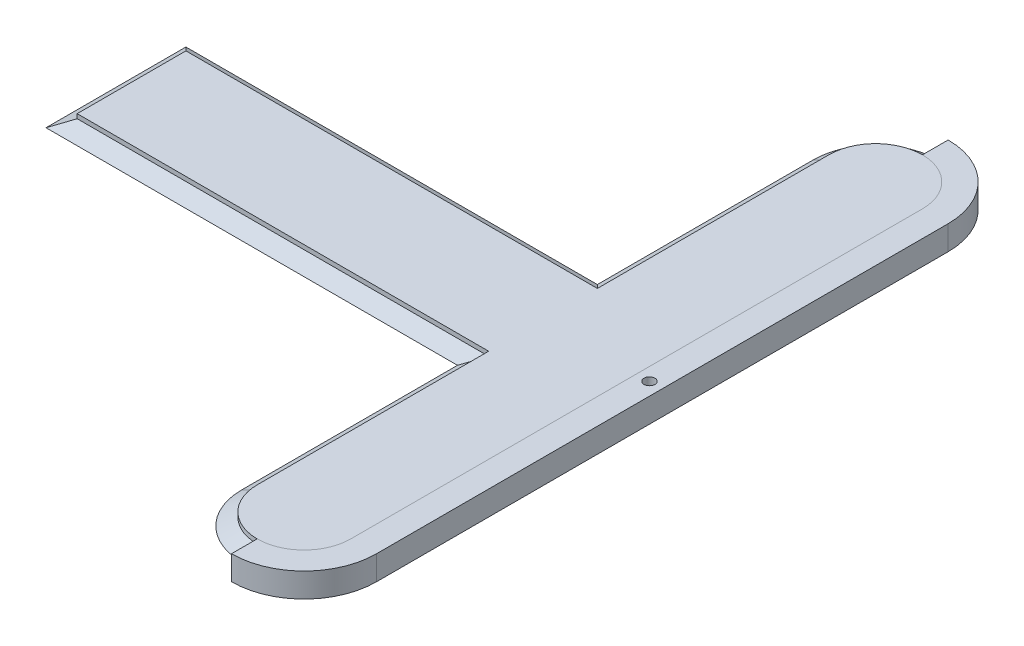
from build123d import *

# Parameters (mm, degrees)
BOSS_EXTRUDE1_DEPTH = 6
BOSS_EXTRUDE2_DEPTH = 6
SKETCH6_R           = 1.35
CUT_EXTRUDE1_DEPTH  = 17.78


with BuildPart() as part:
    # Sketch1 → Boss-Extrude1 (new body)
    with BuildSketch(Plane(origin=(0, 0, 0), x_dir=(1, 0, 0), z_dir=(0, 1, 0))):
        with BuildLine():
            Line((0, -13.421553628), (101.6, -13.421553628))
            Line((101.6, -13.421553628), (101.6, -70.571553628))
            ThreePointArc((101.6, -70.571553628), (113.157, -82.128553628), (124.714, -70.571553628))
            Line((124.714, -70.571553628), (124.714, 70.571553628))
            ThreePointArc((124.714, 70.571553628), (113.157, 82.128553628), (101.6, 70.571553628))
            Line((101.6, 70.571553628), (101.6, 13.421553628))
            Line((101.6, 13.421553628), (0, 13.421553628))
            Line((0, 13.421553628), (0, -13.421553628))
        make_face()
    extrude(amount=BOSS_EXTRUDE1_DEPTH)

    # Sweep1: sweep along a curve in space
    with BuildLine() as sweep1_path:
        ThreePointArc((113.157, 3, 82.128553628), (104.98496693, 3, 78.743586698), (101.6, 3, 70.571553628))
        Line((101.6, 3, 70.571553628), (101.6, 3, 13.421553628))
        Line((101.6, 3, 13.421553628), (0, 3, 13.421553628))
        Line((0, 3, 13.421553628), (0, 3, -13.421553628))
        Line((0, 3, -13.421553628), (101.6, 3, -13.421553628))
        Line((101.6, 3, -13.421553628), (101.6, 3, -70.571553628))
        ThreePointArc((101.6, 3, -70.571553628), (104.98496693, 3, -78.743586698), (113.157, 3, -82.128553628))
    # Sketch4 → Sweep1 (sweep)
    with BuildSketch(Plane(origin=(113.157, 0, 0), x_dir=(0, 0, -1), z_dir=(1, 0, 0))):
        Polygon((82.128553628, 4.910343042), (82.128553628, 1.060343042), (85.978553628, 2.985343042), align=None)
    sweep(path=sweep1_path.line, transition=Transition.RIGHT)


with BuildPart() as body_2:
    # Sketch5 → Boss-Extrude2 (new body)
    with BuildSketch(Plane(origin=(0, 6, 0), x_dir=(1, 0, 0), z_dir=(0, 1, 0))):
        with BuildLine():
            Line((131.064, -70.571553628), (131.064, 70.571553628))
            ThreePointArc((131.064, 70.571553628), (125.819161131, 83.233714759), (113.157, 88.478553628))
            Line((113.157, 88.478553628), (113.157, 82.128553628))
            ThreePointArc((113.157, 82.128553628), (121.32903307, 78.743586698), (124.714, 70.571553628))
            Line((124.714, 70.571553628), (124.714, -70.571553628))
            ThreePointArc((124.714, -70.571553628), (121.32903307, -78.743586698), (113.157, -82.128553628))
            Line((113.157, -82.128553628), (113.157, -88.478553628))
            ThreePointArc((113.157, -88.478553628), (125.819161131, -83.233714759), (131.064, -70.571553628))
        make_face()
    extrude(amount=-BOSS_EXTRUDE2_DEPTH)

    # Sketch6 → Cut-Extrude1 (cut)
    with BuildSketch(Plane(origin=(0, 6, 0), x_dir=(1, 0, 0), z_dir=(0, 1, 0))):
        with Locations(Location((127.889, 0, 0), (0, 0, 270))):
            Circle(SKETCH6_R)
    extrude(amount=-CUT_EXTRUDE1_DEPTH, mode=Mode.SUBTRACT)


solid = Compound([part.part, body_2.part])
